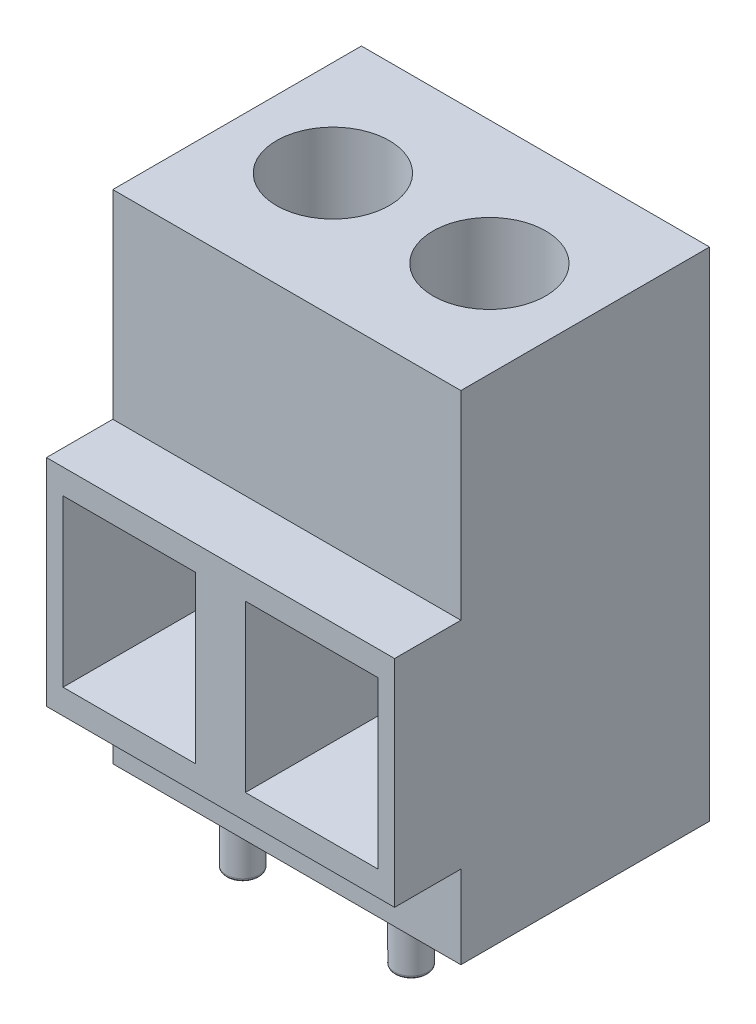
from build123d import *
from build123d.topology import SkipClean

# Parameters (mm, degrees)
SKETCH_1_W                    = 15
SKETCH_1_H                    = 30
SKETCH_1_W_2                  = 4
SKETCH_1_H_2                  = 13
EXTRUDE_1_DEPTH               = 10.5
SKETCH_3_R                    = 3.4
CUT_EXTRUDE_1_DEPTH           = 8
SKETCH_4_W                    = 8
SKETCH_4_H                    = 10
CUT_EXTRUDE_3_DEPTH           = 16
CUT_EXTRUDE_3_DRAFT           = -6
CUT_EXTRUDE_3_PROFILE_2_DEPTH = 16
CUT_EXTRUDE_3_PROFILE_2_DRAFT = -6
CUT_EXTRUDE_5_DEPTH           = 1
CUT_EXTRUDE_6_DEPTH           = 1
SKETCH_9_R                    = 1
EXTRUDE_2_DEPTH               = 4
FILLET_3_R                    = 0.2


with BuildPart() as part:
    # Эскиз1 → Бобышка-Вытянуть1 (new, symmetric)
    with BuildSketch(Plane(origin=(0, 0, 0), x_dir=(0, 0, -1), z_dir=(1, 0, 0))):
        Rectangle(SKETCH_1_W, SKETCH_1_H)
        with Locations((-9.5, -3.5)):
            Rectangle(SKETCH_1_W_2, SKETCH_1_H_2)
    extrude(amount=EXTRUDE_1_DEPTH, both=True)

    # Эскиз3 → Вырез-Вытянуть1 (cut)
    with BuildSketch(Plane(origin=(0, 15, 0), x_dir=(1, 0, 0), z_dir=(0, 1, 0))):
        with Locations(Location((-4.72, 0, 0), (0, 0, 270))):
            Circle(SKETCH_3_R)
        with Locations(Location((4.72, 0, 0), (0, 0, 270))):
            Circle(SKETCH_3_R)
    extrude(amount=-CUT_EXTRUDE_1_DEPTH, mode=Mode.SUBTRACT)


with BuildPart() as cut_extrude_3_tool:
    # Эскиз4 → Вырез-Вытянуть3 (with draft: the straight prism first)
    with BuildSketch(Plane.XY.offset(11.5)):
        with Locations((-5.5, -3.5)):
            Rectangle(SKETCH_4_W, SKETCH_4_H)
    extrude(amount=-CUT_EXTRUDE_3_DEPTH)
    # Вырез-Вытянуть3: the draft: its side faces are tilted about the plane it starts from
    cut_extrude_3_sides = [cut_extrude_3_tool.faces().sort_by_distance(p)[0] for p in [
        (-5.5, -8.5, 3.5),
        (-1.5, -3.5, 3.5),
        (-5.5, 1.5, 3.5),
        (-9.5, -3.5, 3.5),
    ]]
    draft(cut_extrude_3_sides, Plane.XY.offset(11.5), CUT_EXTRUDE_3_DRAFT)


with BuildPart() as part_1:
    add(part.part)

    # Вырез-Вытянуть3: cut by cut_extrude_3_tool
    add(cut_extrude_3_tool.part, mode=Mode.SUBTRACT)


with BuildPart() as cut_extrude_3_profile_2_tool:
    # Эскиз4 → Вырез-Вытянуть3 profile 2 (with draft: the straight prism first)
    with BuildSketch(Plane.XY.offset(11.5)):
        with Locations((5.5, -3.5)):
            Rectangle(SKETCH_4_W, SKETCH_4_H)
    extrude(amount=-CUT_EXTRUDE_3_PROFILE_2_DEPTH)
    # Вырез-Вытянуть3 profile 2: the draft: its side faces are tilted about the plane it starts from
    cut_extrude_3_profile_2_sides = [cut_extrude_3_profile_2_tool.faces().sort_by_distance(p)[0] for p in [
        (5.5, -8.5, 3.5),
        (9.5, -3.5, 3.5),
        (5.5, 1.5, 3.5),
        (1.5, -3.5, 3.5),
    ]]
    draft(cut_extrude_3_profile_2_sides, Plane.XY.offset(11.5), CUT_EXTRUDE_3_PROFILE_2_DRAFT)


with BuildPart() as part_2:
    add(part_1.part)

    # Вырез-Вытянуть3 profile 2: cut by cut_extrude_3_profile_2_tool
    add(cut_extrude_3_profile_2_tool.part, mode=Mode.SUBTRACT)

    # Эскиз7 → Вырез-Вытянуть5 (cut)
    with BuildSketch(Plane(origin=(0, 7, 0), x_dir=(1, 0, 0), z_dir=(0, 1, 0))):
        with BuildLine():
            ThreePointArc((-8.12, 1e-09), (-8.110745992, -0.250682298), (-8.083034344, -0.5))
            Line((-8.083034344, -0.5), (-1.356965656, -0.5))
            ThreePointArc((-1.356965656, -0.5), (-1.329254008, -0.250682299), (-1.32, 0))
            ThreePointArc((-1.32, 0), (-1.329254008, 0.250682299), (-1.356965656, 0.5))
            Line((-1.356965656, 0.5), (-8.083034344, 0.5))
            ThreePointArc((-8.083034344, 0.5), (-8.110745992, 0.250682299), (-8.12, 1e-09))
        make_face()
    extrude(amount=-CUT_EXTRUDE_5_DEPTH, mode=Mode.SUBTRACT)

    # Эскиз8 → Вырез-Вытянуть6 (cut)
    with SkipClean():  # the faces are left unmerged after this step: merging them gives an invalid solid
        with BuildSketch(Plane(origin=(0, 7, 0), x_dir=(1, 0, 0), z_dir=(0, 1, 0))):
            with BuildLine():
                Line((1.356965656, 0.5), (8.083034344, 0.5))
                ThreePointArc((8.083034344, 0.5), (8.12, 0), (8.083034344, -0.5))
                Line((8.083034344, -0.5), (1.356965656, -0.5))
                ThreePointArc((1.356965656, -0.5), (1.32, 0), (1.356965656, 0.5))
            make_face()
        extrude(amount=-CUT_EXTRUDE_6_DEPTH, mode=Mode.SUBTRACT)

    # Эскиз9 → Бобышка-Вытянуть2 (add)
    with SkipClean():  # the faces are left unmerged after this step: merging them gives an invalid solid
        with BuildSketch(Plane.XZ.offset(15)):
            with Locations(Location((-5.08, 5.08, 0), (0, 0, 90))):
                Circle(SKETCH_9_R)
            with Locations(Location((5.08, 5.08, 0), (0, 0, 90))):
                Circle(SKETCH_9_R)
            with Locations(Location((5.08, -5.08, 0), (0, 0, 90))):
                Circle(SKETCH_9_R)
            with Locations(Location((-5.08, -5.08, 0), (0, 0, 90))):
                Circle(SKETCH_9_R)
        extrude(amount=EXTRUDE_2_DEPTH)

    # Скругление3
    fillet_3_edges = [part_2.edges().sort_by_distance(p)[0] for p in [
        (-5.08, -19, 4.08),
        (5.08, -19, 4.08),
        (5.08, -19, -6.08),
        (-5.08, -19, -6.08),
    ]]
    fillet(fillet_3_edges, radius=FILLET_3_R)


solid = part_2.part
